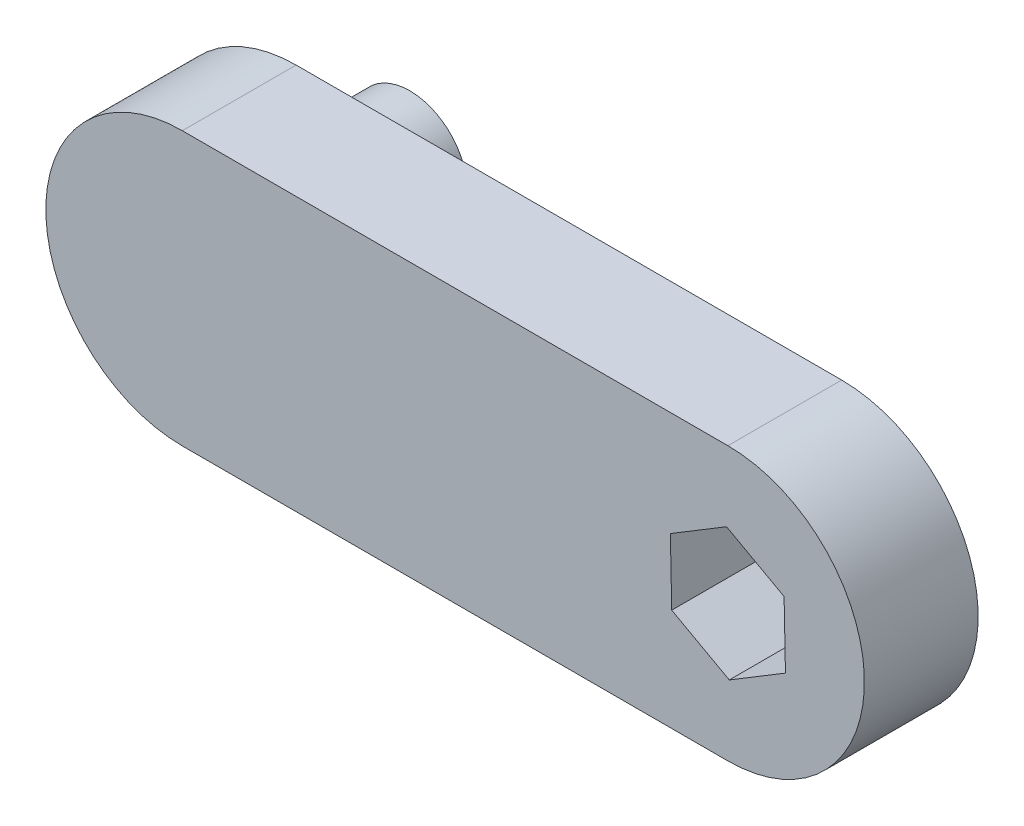
from build123d import *

# Parameters (mm, degrees)
EXTRUDE_1_DEPTH = 5
SKETCH_3_R      = 2.52
EXTRUDE_3_DEPTH = 5


with BuildPart() as part:
    # 草图1 → 凸台-拉伸1 (new body)
    with BuildSketch(Plane.XY):
        with BuildLine():
            Line((0, 6), (23.979571043, 6))
            ThreePointArc((23.979571043, 6), (29.979571043, 0), (23.979571043, -6))
            Line((23.979571043, -6), (0, -6))
            ThreePointArc((0, -6), (-6, 0), (0, 6))
        make_face()
        Polygon((26.50899235, -1.391172594), (26.449072504, 1.494956812), (23.919651197, 2.886129406), (21.450149737, 1.391172594), (21.510069583, -1.494956812), (24.039490889, -2.886129406), align=None, mode=Mode.SUBTRACT)
    extrude(amount=EXTRUDE_1_DEPTH)

    # 草图3 → 凸台-拉伸3 (add)
    with BuildSketch(Plane(origin=(0, 0, 0), x_dir=(-1, 0, 0), z_dir=(0, 0, -1))):
        with Locations(Location((0, 0, 0), (0, 0, 180))):
            Circle(SKETCH_3_R)
    extrude(amount=EXTRUDE_3_DEPTH)


solid = part.part
